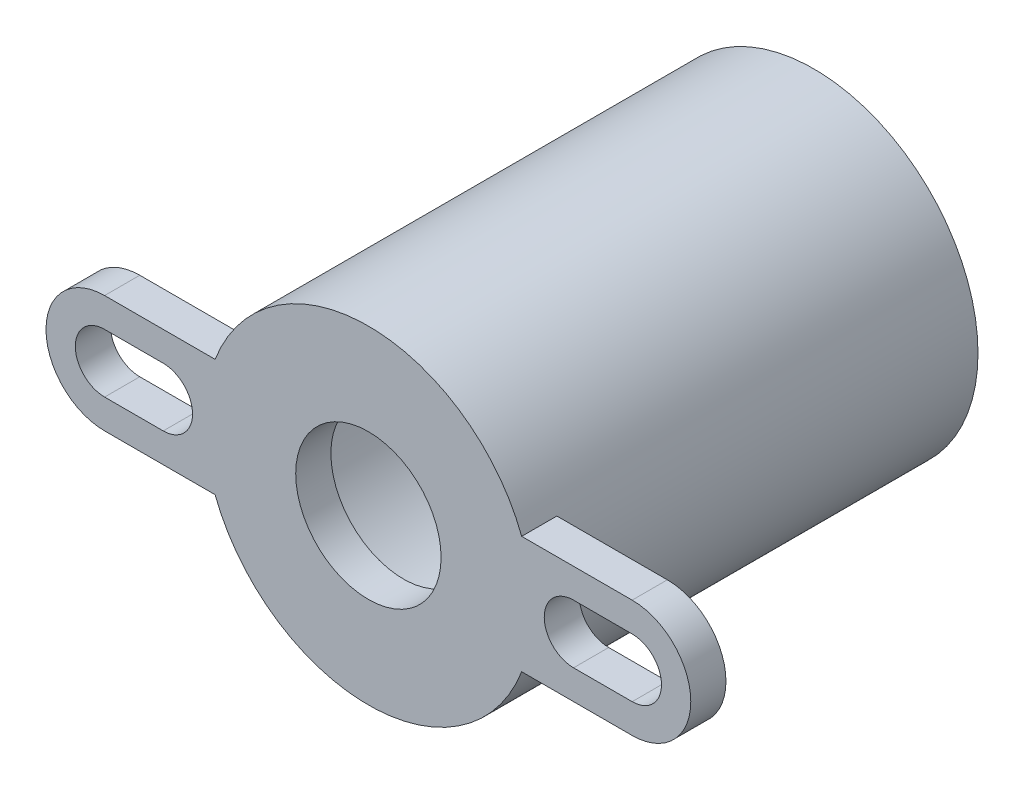
from build123d import *

# Parameters (mm, degrees)
SKETCH1_R           = 14
BOSS_EXTRUDE1_DEPTH = 3
SKETCH2_R           = 6.2
CUT_EXTRUDE1_DEPTH  = 8
BOSS_EXTRUDE2_START = 35
SKETCH3_R           = 14
SKETCH3_R_2         = 11.5
BOSS_EXTRUDE2_DEPTH = 35
CUT_EXTRUDE2_DEPTH  = 63.617888818


with BuildPart() as part:
    # Sketch1 → Boss-Extrude1 (new body)
    with BuildSketch(Plane.XY):
        with Locations((22.5, 0)):
            Circle(SKETCH1_R)
        with BuildLine():
            Line((0, 5), (45, 5))
            ThreePointArc((45, 5), (50, 0), (45, -5))
            Line((45, -5), (0, -5))
            ThreePointArc((0, -5), (-5, 0), (0, 5))
        make_face()
    extrude(amount=BOSS_EXTRUDE1_DEPTH)

    # Sketch2 → Cut-Extrude1 (cut)
    with BuildSketch(Plane(origin=(0, 0, 0), x_dir=(-1, 0, 0), z_dir=(0, 0, -1))):
        with Locations((-22.5, 0)):
            Circle(SKETCH2_R)
    extrude(amount=-CUT_EXTRUDE1_DEPTH, mode=Mode.SUBTRACT)

    # Sketch3 → Boss-Extrude2 (add)
    with BuildSketch(Plane(origin=(0, 0, 0), x_dir=(-1, 0, 0), z_dir=(0, 0, -1)).offset(BOSS_EXTRUDE2_START)):
        with Locations((-22.5, 0)):
            Circle(SKETCH3_R)
        with Locations((-22.5, 0)):
            Circle(SKETCH3_R_2, mode=Mode.SUBTRACT)
    extrude(amount=-BOSS_EXTRUDE2_DEPTH)

    # Sketch4 → Cut-Extrude2 (cut, through all)
    with BuildSketch(Plane(origin=(0, 0, 0), x_dir=(-1, 0, 0), z_dir=(0, 0, -1))):
        with BuildLine():
            Line((-40, -2.5), (-45, -2.5))
            ThreePointArc((-45, -2.5), (-47.5, 0), (-45, 2.5))
            Line((-45, 2.5), (-40, 2.5))
            ThreePointArc((-40, 2.5), (-37.5, 0), (-40, -2.5))
        make_face()
        with BuildLine():
            Line((-5, 2.5), (0, 2.5))
            ThreePointArc((0, 2.5), (2.5, 0), (0, -2.5))
            Line((0, -2.5), (-5, -2.5))
            ThreePointArc((-5, -2.5), (-7.5, 0), (-5, 2.5))
        make_face()
    extrude(amount=-CUT_EXTRUDE2_DEPTH, mode=Mode.SUBTRACT)


solid = part.part
